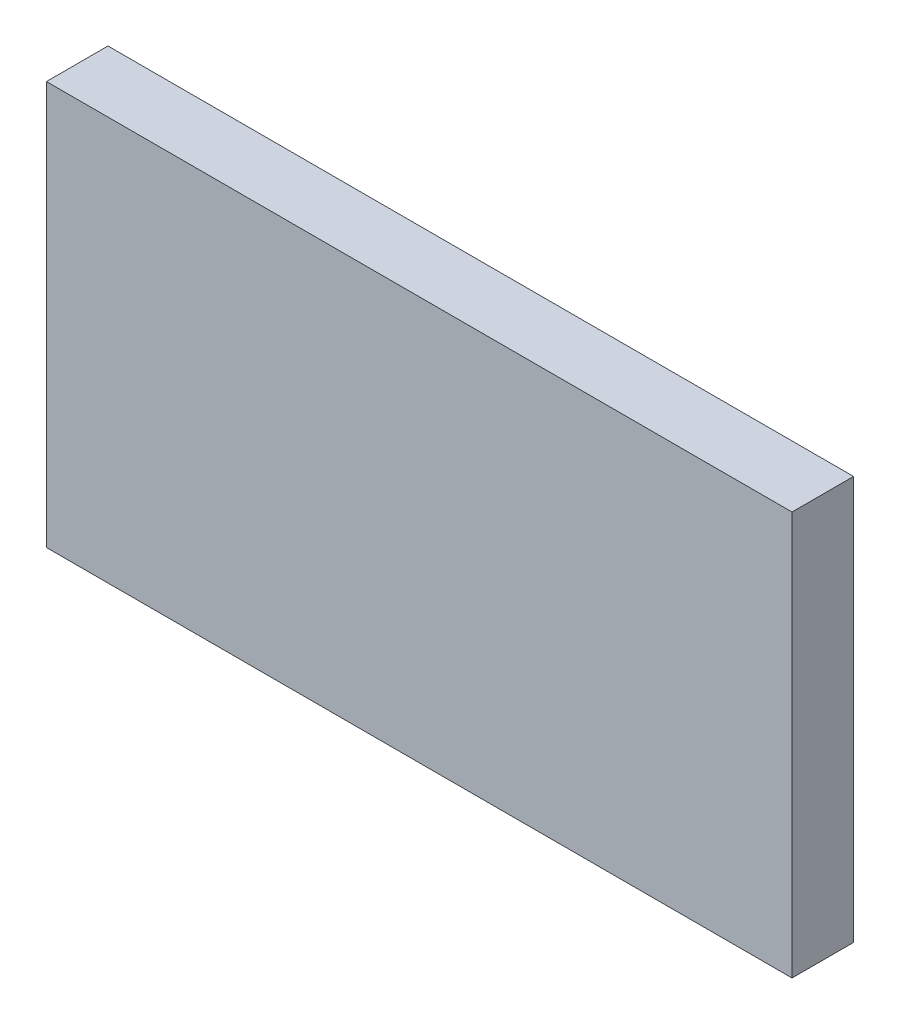
from build123d import *

# Parameters (mm, degrees)
ESQUISSE1_W             = 109
ESQUISSE1_H             = 59
BOSS_EXTRU_1_DEPTH      = 9
ESQUISSE2_W             = 103
ESQUISSE2_H             = 53
ENL_V_MAT_EXTRU_1_DEPTH = 8
ESQUISSE3_W             = 10
ESQUISSE3_H             = 10
BOSS_EXTRU_2_DEPTH      = 9
ESQUISSE4_W             = 10
ESQUISSE4_H             = 10
ENL_V_MAT_EXTRU_2_DEPTH = 2


with BuildPart() as part:
    # Esquisse1 → Boss.-Extru.1 (new body)
    with BuildSketch(Plane.XY):
        with Locations((54.5, -29.5)):
            Rectangle(ESQUISSE1_W, ESQUISSE1_H)
    extrude(amount=BOSS_EXTRU_1_DEPTH)

    # Esquisse2 → Enlèv. mat.-Extru.1 (cut)
    with BuildSketch(Plane.XY):
        with Locations((54.5, -29.5)):
            Rectangle(ESQUISSE2_W, ESQUISSE2_H)
    extrude(amount=ENL_V_MAT_EXTRU_1_DEPTH, mode=Mode.SUBTRACT)

    # Esquisse3 → Boss.-Extru.2 (add)
    with BuildSketch(Plane.XY):
        with Locations((101, -8)):
            Rectangle(ESQUISSE3_W, ESQUISSE3_H)
        with Locations((101, -51)):
            Rectangle(ESQUISSE3_W, ESQUISSE3_H)
        with Locations((8, -51)):
            Rectangle(ESQUISSE3_W, ESQUISSE3_H)
        with Locations((8, -8)):
            Rectangle(ESQUISSE3_W, ESQUISSE3_H)
    extrude(amount=BOSS_EXTRU_2_DEPTH)

    # Esquisse4 → Enlèv. mat.-Extru.2 (cut)
    with BuildSketch(Plane.XY):
        with Locations((101, -8)):
            Rectangle(ESQUISSE4_W, ESQUISSE4_H)
        with Locations((101, -51)):
            Rectangle(ESQUISSE4_W, ESQUISSE4_H)
        with Locations((8, -51)):
            Rectangle(ESQUISSE4_W, ESQUISSE4_H)
        with Locations((8, -8)):
            Rectangle(ESQUISSE4_W, ESQUISSE4_H)
    extrude(amount=ENL_V_MAT_EXTRU_2_DEPTH, mode=Mode.SUBTRACT)


solid = part.part
